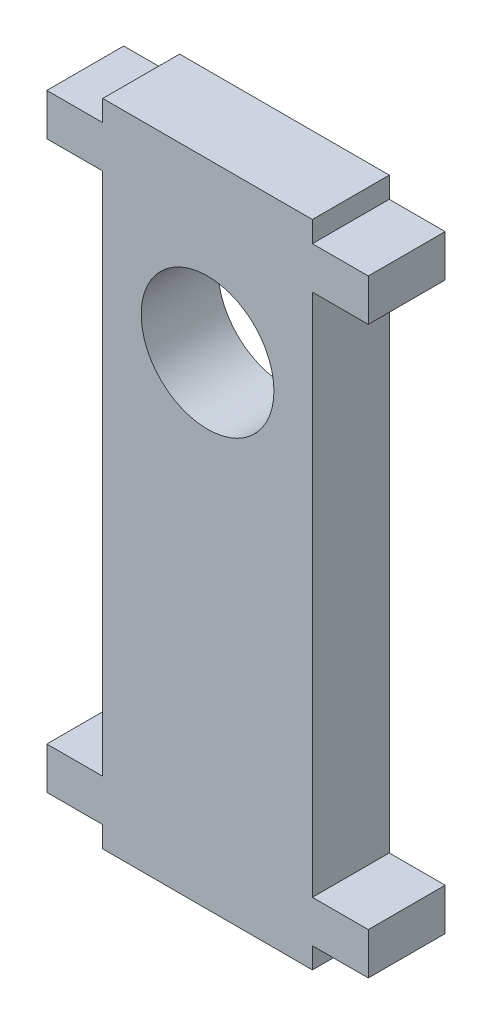
from build123d import *

# Parameters (mm, degrees)
ESQUISSE1_R        = 9.5
BOSS_EXTRU_1_DEPTH = 11


with BuildPart() as part:
    # Esquisse1 → Boss.-Extru.1 (new body)
    with BuildSketch(Plane.XY):
        Polygon((0, 81), (0, 6), (-8, 6), (-8, 0), (0, 0), (0, -3), (30, -3), (30, 0), (38, 0), (38, 6), (30, 6), (30, 81), (38, 81), (38, 87), (30, 87), (30, 90), (25, 90), (5, 90), (0, 90), (0, 87), (-8, 87), (-8, 81), align=None)
        with Locations((15, 66)):
            Circle(ESQUISSE1_R, mode=Mode.SUBTRACT)
    extrude(amount=BOSS_EXTRU_1_DEPTH)


solid = part.part
